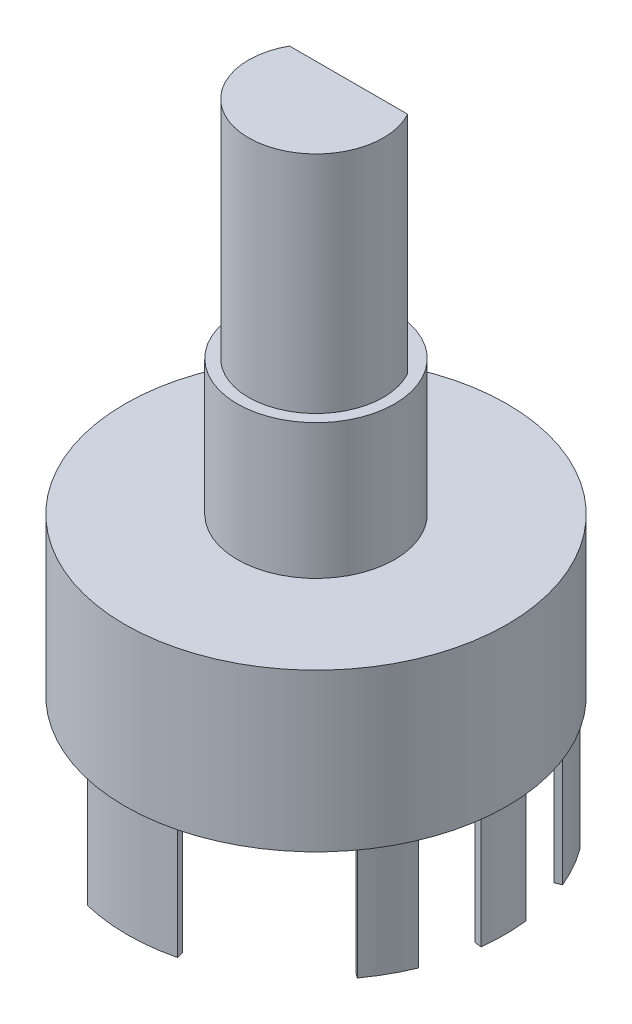
from build123d import *

# Parameters (mm, degrees)
BOSS_EXTRUDE1_DEPTH     = 5
CUT_EXTRUDE1_DEPTH      = 26.951878545
CUT_EXTRUDE1_DEPTH_BACK = 26.951878545
SKETCH4_W               = 1.55
SKETCH4_H               = 10


with BuildPart() as part:
    # Sketch2 → Revolve1 (revolve)
    with BuildSketch(Plane.XY):
        Polygon((0, 0), (8.5, 0), (8.5, 7), (3.5, 7), (3.5, 13), (3, 13), (3, 23), (0, 23), align=None)
    revolve(axis=Axis((0, -1000, 0), (0, 1, 0)))

    # Sketch3 → Boss-Extrude1 (add)
    with BuildSketch(Plane.XZ):
        with BuildLine():
            Line((6.544190201, 4.773214286), (6.786567616, 4.95))
            ThreePointArc((6.786567616, 4.95), (7.327590965, 4.106873586), (7.76439466, 3.205335485))
            Line((7.76439466, 3.205335485), (7.48709485, 3.090859217))
            ThreePointArc((7.48709485, 3.090859217), (7.065891288, 3.960199529), (6.544190201, 4.773214286))
        make_face()
        with BuildLine():
            Line((8.042397221, 0.964285714), (8.340263785, 1))
            ThreePointArc((8.340263785, 1), (8.4, 0), (8.340263785, -1))
            Line((8.340263785, -1), (8.042397221, -0.964285714))
            ThreePointArc((8.042397221, -0.964285714), (8.1, 0), (8.042397221, 0.964285714))
        make_face()
        with BuildLine():
            Line((7.48709485, -3.090859217), (7.76439466, -3.205335485))
            ThreePointArc((7.76439466, -3.205335485), (7.327590965, -4.106873586), (6.786567616, -4.95))
            Line((6.786567616, -4.95), (6.544190201, -4.773214286))
            ThreePointArc((6.544190201, -4.773214286), (7.065891288, -3.960199529), (7.48709485, -3.090859217))
        make_face()
        with BuildLine():
            Line((-1.928571429, -7.867058678), (-2, -8.158431222))
            ThreePointArc((-2, -8.158431222), (0, -8.4), (2, -8.158431222))
            Line((2, -8.158431222), (1.928571429, -7.867058678))
            ThreePointArc((1.928571429, -7.867058678), (0, -8.1), (-1.928571429, -7.867058678))
        make_face()
        with BuildLine():
            Line((-1.928571429, 7.867058678), (-2, 8.158431222))
            ThreePointArc((-2, 8.158431222), (0, 8.4), (2, 8.158431222))
            Line((2, 8.158431222), (1.928571429, 7.867058678))
            ThreePointArc((1.928571429, 7.867058678), (0, 8.1), (-1.928571429, 7.867058678))
        make_face()
    extrude(amount=BOSS_EXTRUDE1_DEPTH)

    # Sketch4 → Cut-Extrude1 (cut, two sides: drawn at the far end of the back side and taken through both)
    with BuildSketch(Plane(origin=(0, 0, 0), x_dir=(0, 0, -1), z_dir=(1, 0, 0)).offset(-CUT_EXTRUDE1_DEPTH_BACK)):
        with Locations((2.225, 18)):
            Rectangle(SKETCH4_W, SKETCH4_H)
    extrude(amount=CUT_EXTRUDE1_DEPTH + CUT_EXTRUDE1_DEPTH_BACK, mode=Mode.SUBTRACT)


solid = part.part
